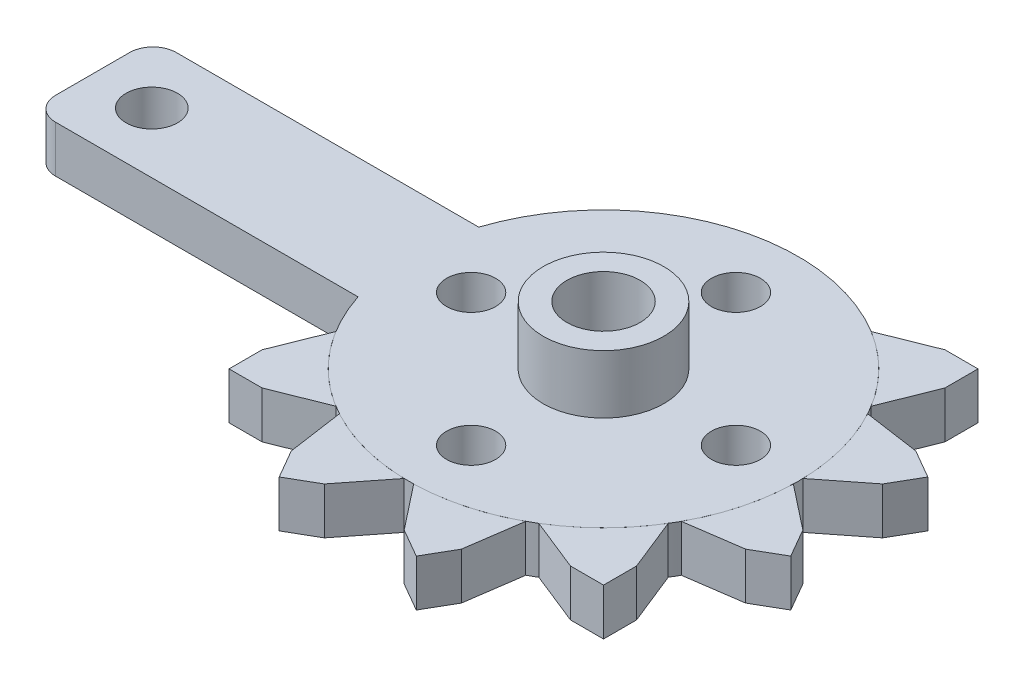
from build123d import *

# Parameters (mm, degrees)
SKETCH1_R             = 1.575
SKETCH1_R_2           = 3.875
SKETCH1_R_3           = 1.65
BOSS_EXTRUDE1_DEPTH   = 3
SKETCH1_R_4           = 2.35
BOSS_EXTRUDE1_2_DEPTH = 3
SKETCH1_3_R           = 3.875
SKETCH1_3_R_2         = 2.35
BOSS_EXTRUDE2_DEPTH   = 6.75
BOSS_EXTRUDE3_DEPTH   = 3
CIRPATTERN3_COUNT     = 6
CIRPATTERN3_ANGLE     = 150
CIRPATTERN4_COUNT     = 2
CIRPATTERN4_ANGLE     = 30
FILLET2_R             = 1.5


with BuildPart() as part:
    # Sketch1 → Boss-Extrude1 (new body)
    with BuildSketch(Plane(origin=(0, 0, 0), x_dir=(1, 0, 0), z_dir=(0, 1, 0))):
        with BuildLine():
            ThreePointArc((-11.884206957, -3.875), (12.5, 0), (-11.884206957, 3.875))
            Line((-11.884206957, 3.875), (-32.8, 3.875))
            Line((-32.8, 3.875), (-32.8, -3.875))
            Line((-32.8, -3.875), (-11.884206957, -3.875))
        make_face()
        with Locations(Location((0, -8.5, 0), (0, 0, 270))):
            Circle(SKETCH1_R, mode=Mode.SUBTRACT)
        with Locations(Location((-8.5, 0, 0), (0, 0, 270))):
            Circle(SKETCH1_R, mode=Mode.SUBTRACT)
        with Locations(Location((0, 0, 0), (0, 0, 270))):
            Circle(SKETCH1_R_2, mode=Mode.SUBTRACT)
        with Locations(Location((0, 8.5, 0), (0, 0, 270))):
            Circle(SKETCH1_R, mode=Mode.SUBTRACT)
        with Locations(Location((8.5, 0, 0), (0, 0, 270))):
            Circle(SKETCH1_R, mode=Mode.SUBTRACT)
        with Locations(Location((-29, 0, 0), (0, 0, 270))):
            Circle(SKETCH1_R_3, mode=Mode.SUBTRACT)
    extrude(amount=BOSS_EXTRUDE1_DEPTH)



with BuildPart() as body_2:
    # Sketch1 → Boss-Extrude1 2 (new body)
    with BuildSketch(Plane(origin=(0, 0, 0), x_dir=(1, 0, 0), z_dir=(0, 1, 0))):
        with Locations(Location((0, 0, 0), (0, 0, 270))):
            Circle(SKETCH1_R_4)
    extrude(amount=BOSS_EXTRUDE1_2_DEPTH)


with BuildPart() as part_1:
    add(part.part)

    add(body_2.part)  # Boss-Extrude2 merges body 2
    # Sketch1<3> → Boss-Extrude2 (add)
    with BuildSketch(Plane(origin=(0, 0, 0), x_dir=(1, 0, 0), z_dir=(0, 1, 0))):
        with Locations(Location((0, 0, 0), (0, 0, 270))):
            Circle(SKETCH1_3_R)
        with Locations(Location((0, 0, 0), (0, 0, 270))):
            Circle(SKETCH1_3_R_2, mode=Mode.SUBTRACT)
    extrude(amount=BOSS_EXTRUDE2_DEPTH)

    # Fillet2
    fillet2_edges = [part_1.edges().sort_by_distance(p)[0] for p in [
        (-32.8, 1.5, 3.875),
        (-32.8, 1.5, -3.875),
    ]]
    fillet(fillet2_edges, radius=FILLET2_R)


with BuildPart() as body_2_2:
    # Sketch5 → Boss-Extrude3 (new body)
    with BuildSketch(Plane(origin=(0, 3, 0), x_dir=(1, 0, 0), z_dir=(0, 1, 0))):
        Polygon((-4.011695199, -14.971850307), (-4.881028443, -14.738913167), (-4.399923767, -16.420739047), align=None)
        Polygon((-4.399923767, -16.420739047), (-4.881028443, -14.738913167), (-5.460583939, -14.58362174), align=None)
        with BuildLine():
            Line((-4.881028443, -14.738913167), (-5.953039775, -10.991420174))
            ThreePointArc((-5.953039775, -10.991420174), (-5.966658953, -10.984033), (-5.980268965, -10.97662895))
            Line((-5.980268965, -10.97662895), (-5.460583939, -14.58362174))
            Line((-5.460583939, -14.58362174), (-4.881028443, -14.738913167))
        make_face()
        with BuildLine():
            Line((-3.142361955, -15.204787448), (-0.340226412, -12.495368982))
            ThreePointArc((-0.340226412, -12.495368982), (-3.235238064, -12.074072829), (-5.953039775, -10.991420174))
            Line((-5.953039775, -10.991420174), (-4.881028443, -14.738913167))
            Line((-4.881028443, -14.738913167), (-4.011695199, -14.971850307))
            Line((-4.011695199, -14.971850307), (-3.142361955, -15.204787448))
        make_face()
        Polygon((-4.399923767, -16.420739047), (-3.142361955, -15.204787448), (-4.011695199, -14.971850307), align=None)
        Polygon((-2.56280646, -15.360078875), (-3.142361955, -15.204787448), (-4.399923767, -16.420739047), align=None)
        with BuildLine():
            ThreePointArc((-0.30924963, -12.496174001), (-0.32473827, -12.49578109), (-0.340226412, -12.495368982))
            Line((-0.340226412, -12.495368982), (-3.142361955, -15.204787448))
            Line((-3.142361955, -15.204787448), (-2.56280646, -15.360078875))
            Line((-2.56280646, -15.360078875), (-0.30924963, -12.496174001))
        make_face()
    extrude(amount=-BOSS_EXTRUDE3_DEPTH)


with BuildPart() as cirpattern3_1:
    # CirPattern3: pattern copy
    add(body_2_2.part.rotate(Axis((0, 0, 0), (0, 1, 0)), 1 * CIRPATTERN3_ANGLE / (CIRPATTERN3_COUNT - 1)))


with BuildPart() as cirpattern3_2:
    # CirPattern3: pattern copy
    add(body_2_2.part.rotate(Axis((0, 0, 0), (0, 1, 0)), 2 * CIRPATTERN3_ANGLE / (CIRPATTERN3_COUNT - 1)))


with BuildPart() as cirpattern3_3:
    # CirPattern3: pattern copy
    add(body_2_2.part.rotate(Axis((0, 0, 0), (0, 1, 0)), 3 * CIRPATTERN3_ANGLE / (CIRPATTERN3_COUNT - 1)))


with BuildPart() as cirpattern3_4:
    # CirPattern3: pattern copy
    add(body_2_2.part.rotate(Axis((0, 0, 0), (0, 1, 0)), 4 * CIRPATTERN3_ANGLE / (CIRPATTERN3_COUNT - 1)))


with BuildPart() as cirpattern3_5:
    # CirPattern3: pattern copy
    add(body_2_2.part.rotate(Axis((0, 0, 0), (0, 1, 0)), 5 * CIRPATTERN3_ANGLE / (CIRPATTERN3_COUNT - 1)))


with BuildPart() as cirpattern4_1:
    # CirPattern4: pattern copy
    add(body_2_2.part.rotate(Axis((0, 0, 0), (0, -1, 0)), 1 * CIRPATTERN4_ANGLE / (CIRPATTERN4_COUNT - 1)))


solid = Compound([part_1.part, body_2_2.part, cirpattern3_1.part, cirpattern3_2.part, cirpattern3_3.part, cirpattern3_4.part, cirpattern3_5.part, cirpattern4_1.part])
